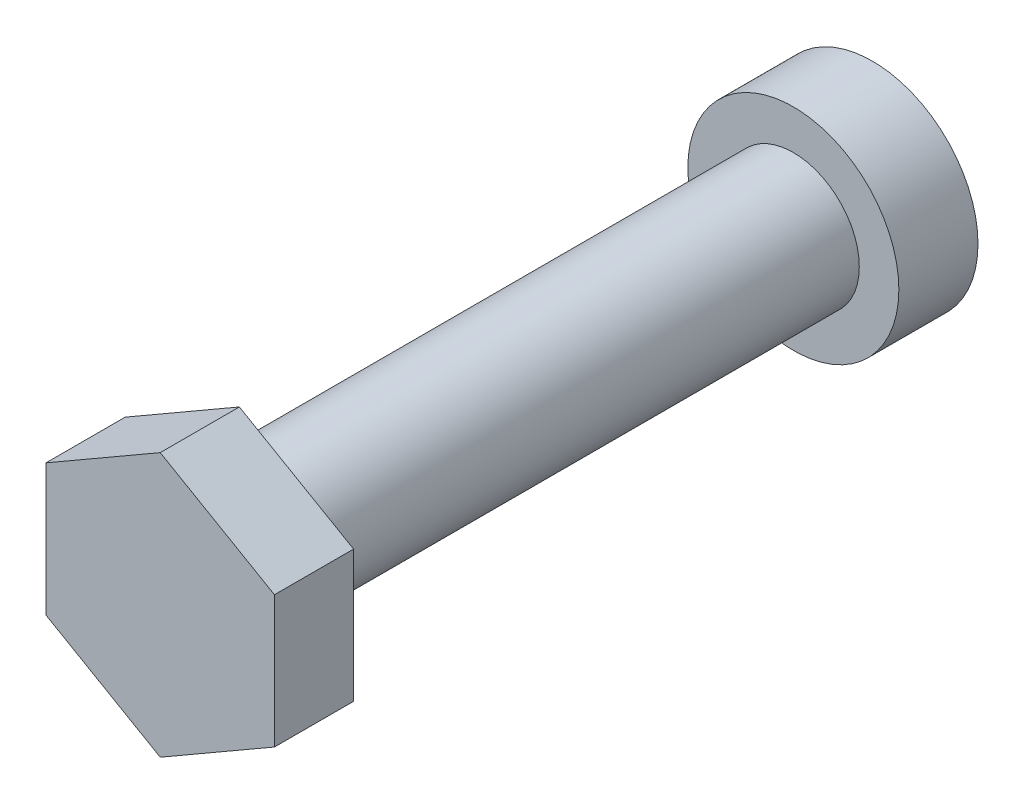
from build123d import *

# Parameters (mm, degrees)
SKETCH1_R           = 2.5
BOSS_EXTRUDE1_DEPTH = 24
BOSS_EXTRUDE2_DEPTH = 3
SKETCH3_R           = 4
BOSS_EXTRUDE3_DEPTH = 3


with BuildPart() as part:
    # Sketch1 → Boss-Extrude1 (new body)
    with BuildSketch(Plane.XY):
        with Locations((0, 0.353270887)):
            Circle(SKETCH1_R)
    extrude(amount=-BOSS_EXTRUDE1_DEPTH)

    # Sketch2 → Boss-Extrude2 (add)
    with BuildSketch(Plane.XY):
        Polygon((4.330127019, -2.5), (4.330127019, 2.5), (0, 5), (-4.330127019, 2.5), (-4.330127019, -2.5), (0, -5), align=None)
    extrude(amount=BOSS_EXTRUDE2_DEPTH)


with BuildPart() as body_2:
    # Sketch3 → Boss-Extrude3 (new body)
    with BuildSketch(Plane(origin=(0, 0, -24), x_dir=(-1, 0, 0), z_dir=(0, 0, -1))):
        with Locations((0, 0.353270887)):
            Circle(SKETCH3_R)
    extrude(amount=-BOSS_EXTRUDE3_DEPTH)


solid = Compound([part.part, body_2.part])
